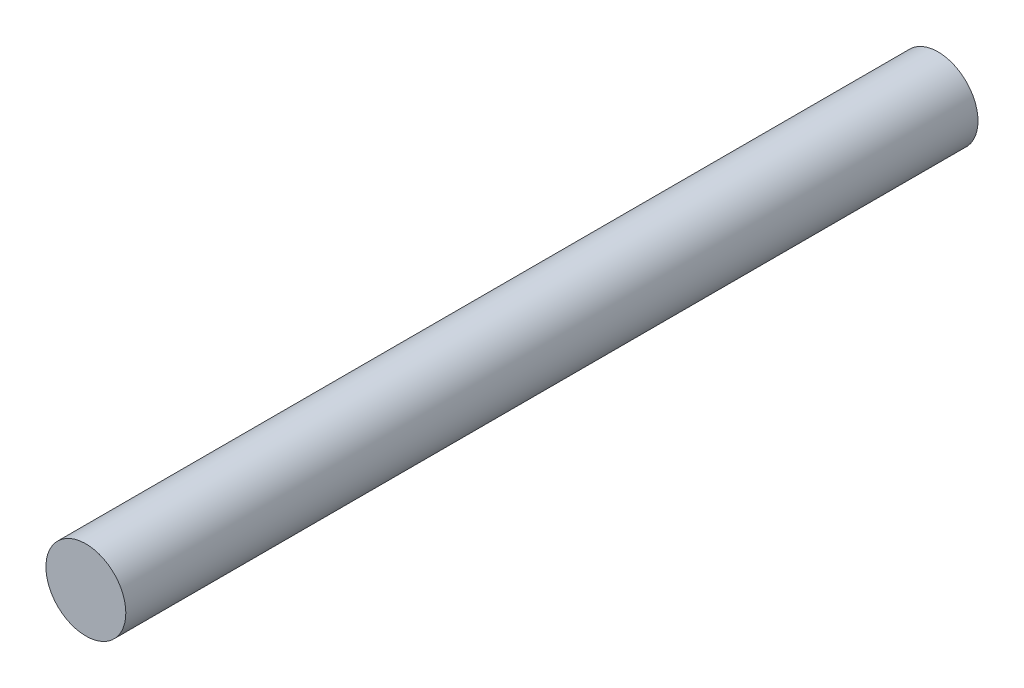
from build123d import *

# Parameters (mm, degrees)
CROQUIS1_R              = 9.525
SALIENTE_EXTRUIR1_DEPTH = 101.6


with BuildPart() as part:
    # Croquis1 → Saliente-Extruir1 (new, symmetric)
    with BuildSketch(Plane.XY):
        Circle(CROQUIS1_R)
    extrude(amount=SALIENTE_EXTRUIR1_DEPTH, both=True)


solid = part.part
